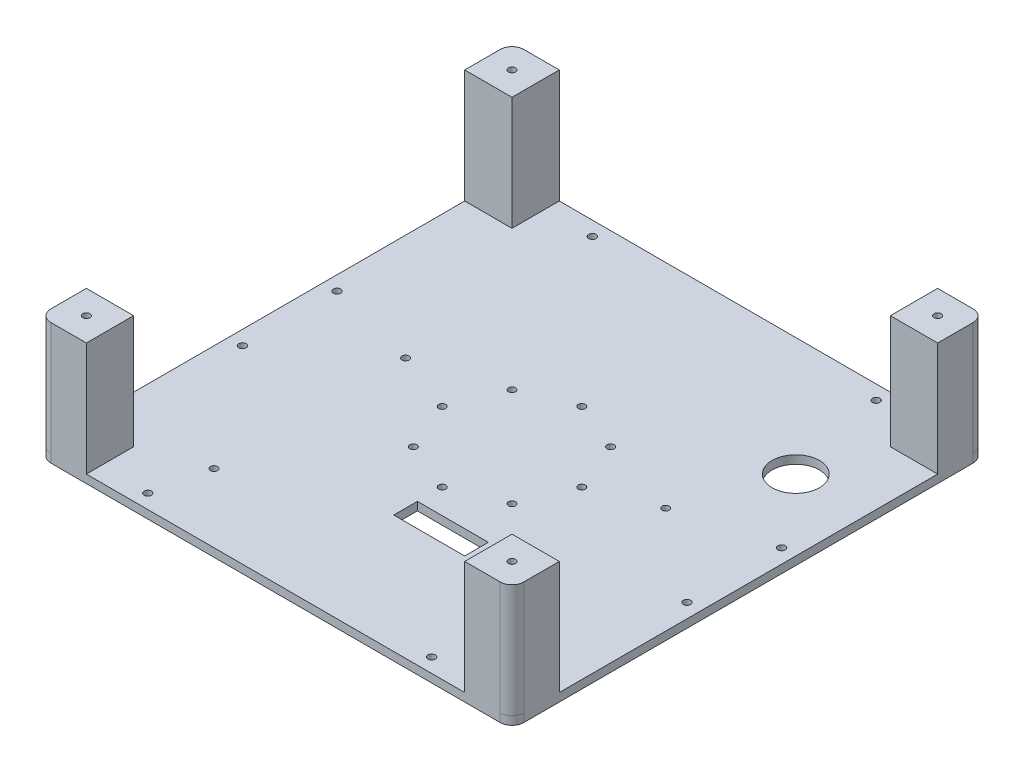
from build123d import *

# Parameters (mm, degrees)
SKETCH_1_R      = 1.5
SKETCH_1_R_2    = 1.55
SKETCH_1_R_3    = 10
SKETCH_1_W      = 30
SKETCH_1_H      = 10
EXTRUDE_1_DEPTH = 3.5
FILLET_1_R      = 5
SKETCH_2_W      = 20
SKETCH_2_H      = 20
SKETCH_2_R      = 1.5
EXTRUDE_2_DEPTH = 48
FILLET_2_R      = 5


with BuildPart() as part:
    # 草图1 → 凸台-拉伸1 (new body)
    with BuildSketch(Plane(origin=(0, 0, 0), x_dir=(1, 0, 0), z_dir=(0, 1, 0))):
        Polygon((-100, 100), (100, 100), (100, -32.687538375), (100, -80.687538375), (100, -100), (-100, -100), (-100, -80.687538375), (-100, -32.687538375), align=None)
        with Locations(Location((-55, 10, 0), (0, 0, 270))):
            Circle(SKETCH_1_R, mode=Mode.SUBTRACT)
        with Locations(Location((-55, -71, 0), (0, 0, 270))):
            Circle(SKETCH_1_R, mode=Mode.SUBTRACT)
        with Locations(Location((55, -71, 0), (0, 0, 90))):
            Circle(SKETCH_1_R, mode=Mode.SUBTRACT)
        with Locations(Location((55, 10, 0), (0, 0, 90))):
            Circle(SKETCH_1_R, mode=Mode.SUBTRACT)
        with Locations(Location((60, 94, 0), (0, 0, 270))):
            Circle(SKETCH_1_R_2, mode=Mode.SUBTRACT)
        with Locations(Location((60, -94, 0), (0, 0, 270))):
            Circle(SKETCH_1_R_2, mode=Mode.SUBTRACT)
        with Locations(Location((94, 20, 0), (0, 0, 270))):
            Circle(SKETCH_1_R_2, mode=Mode.SUBTRACT)
        with Locations(Location((94, -20, 0), (0, 0, 90))):
            Circle(SKETCH_1_R_2, mode=Mode.SUBTRACT)
        with Locations(Location((-60, -94, 0), (0, 0, 90))):
            Circle(SKETCH_1_R_2, mode=Mode.SUBTRACT)
        with Locations(Location((-94, -20, 0), (0, 0, 270))):
            Circle(SKETCH_1_R_2, mode=Mode.SUBTRACT)
        with Locations(Location((-94, 20, 0), (0, 0, 90))):
            Circle(SKETCH_1_R_2, mode=Mode.SUBTRACT)
        with Locations(Location((-60, 94, 0), (0, 0, 90))):
            Circle(SKETCH_1_R_2, mode=Mode.SUBTRACT)
        with Locations(Location((0, 29.5, 0), (0, 0, 270))):
            Circle(SKETCH_1_R, mode=Mode.SUBTRACT)
        with Locations(Location((20.859650045, 20.859650045, 0), (0, 0, 270))):
            Circle(SKETCH_1_R, mode=Mode.SUBTRACT)
        with Locations(Location((29.5, 0, 0), (0, 0, 270))):
            Circle(SKETCH_1_R, mode=Mode.SUBTRACT)
        with Locations(Location((20.859650045, -20.859650045, 0), (0, 0, 270))):
            Circle(SKETCH_1_R, mode=Mode.SUBTRACT)
        with Locations(Location((0, -29.5, 0), (0, 0, 270))):
            Circle(SKETCH_1_R, mode=Mode.SUBTRACT)
        with Locations(Location((-20.859650045, -20.859650045, 0), (0, 0, 270))):
            Circle(SKETCH_1_R, mode=Mode.SUBTRACT)
        with Locations(Location((-29.5, 0, 0), (0, 0, 270))):
            Circle(SKETCH_1_R, mode=Mode.SUBTRACT)
        with Locations(Location((-20.859650045, 20.859650045, 0), (0, 0, 270))):
            Circle(SKETCH_1_R, mode=Mode.SUBTRACT)
        with Locations(Location((70, 50, 0), (0, 0, 270))):
            Circle(SKETCH_1_R_3, mode=Mode.SUBTRACT)
        with Locations((15, -45)):
            Rectangle(SKETCH_1_W, SKETCH_1_H, mode=Mode.SUBTRACT)
    extrude(amount=EXTRUDE_1_DEPTH)

    # 圆角1
    fillet_1_edges = [part.edges().sort_by_distance(p)[0] for p in [
        (-100, 1.75, -100),
        (100, 1.75, -100),
        (100, 1.75, 100),
        (-100, 1.75, 100),
    ]]
    fillet(fillet_1_edges, radius=FILLET_1_R)

    # 草图2 → 凸台-拉伸2 (add)
    # profile 1 of 4: a face of its own
    with BuildSketch(Plane(origin=(0, 3.5, 0), x_dir=(1, 0, 0), z_dir=(0, 1, 0))):
        with Locations((-90, 90)):
            Rectangle(SKETCH_2_W, SKETCH_2_H)
        with Locations(Location((-90, 90, 0), (0, 0, 270))):
            Circle(SKETCH_2_R, mode=Mode.SUBTRACT)
    # profile 2 of 4: a face of its own
    with BuildSketch(Plane(origin=(0, 3.5, 0), x_dir=(1, 0, 0), z_dir=(0, 1, 0))):
        with Locations((90, 90)):
            Rectangle(SKETCH_2_W, SKETCH_2_H)
        with Locations(Location((90, 90, 0), (0, 0, 90))):
            Circle(SKETCH_2_R, mode=Mode.SUBTRACT)
    # profile 3 of 4: a face of its own
    with BuildSketch(Plane(origin=(0, 3.5, 0), x_dir=(1, 0, 0), z_dir=(0, 1, 0))):
        with Locations((90, -90)):
            Rectangle(SKETCH_2_W, SKETCH_2_H)
        with Locations(Location((90, -90, 0), (0, 0, 270))):
            Circle(SKETCH_2_R, mode=Mode.SUBTRACT)
    # profile 4 of 4: a face of its own
    with BuildSketch(Plane(origin=(0, 3.5, 0), x_dir=(1, 0, 0), z_dir=(0, 1, 0))):
        with Locations((-90, -90)):
            Rectangle(SKETCH_2_W, SKETCH_2_H)
        with Locations(Location((-90, -90, 0), (0, 0, 90))):
            Circle(SKETCH_2_R, mode=Mode.SUBTRACT)
    extrude(amount=EXTRUDE_2_DEPTH)

    # 圆角2
    fillet_2_edges = [part.edges().sort_by_distance(p)[0] for p in [
        (100, 27.5, 100),
        (100, 27.5, -100),
        (-100, 27.5, -100),
        (-100, 27.5, 100),
    ]]
    fillet(fillet_2_edges, radius=FILLET_2_R)


solid = part.part
